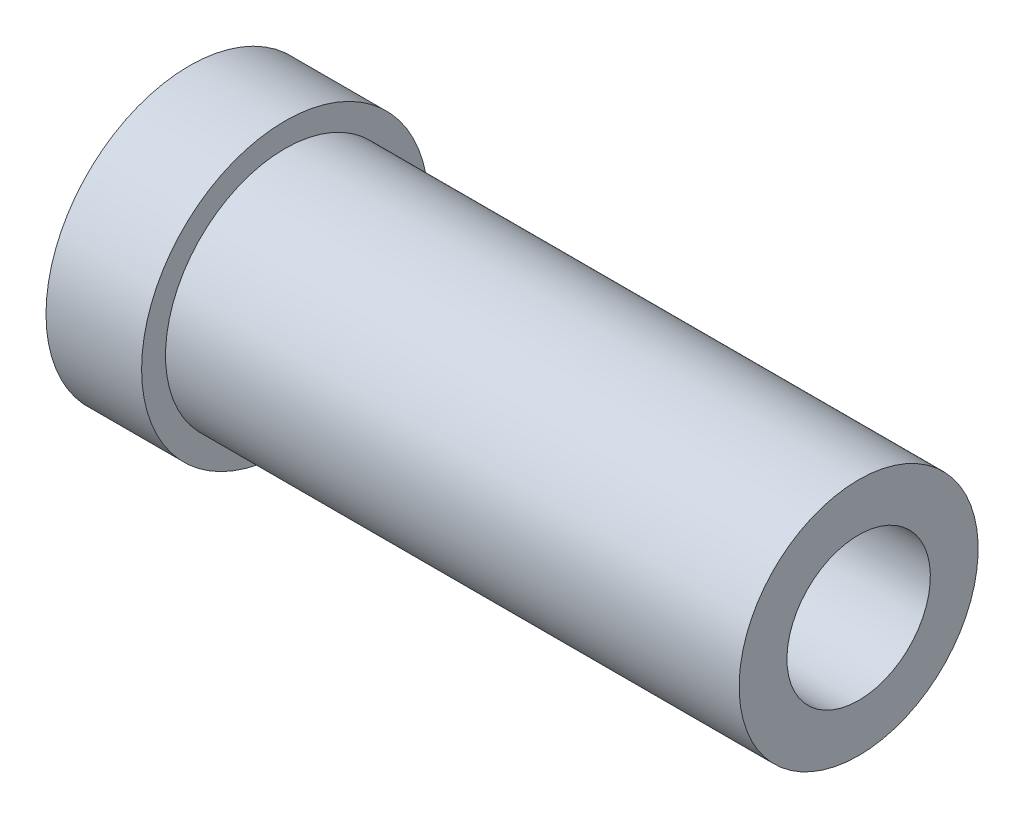
from build123d import *


with BuildPart() as part:
    # Sketch1 → Revolve1 (revolve)
    with BuildSketch(Plane.XY, mode=Mode.PRIVATE) as revolve1_sk:
        Polygon((3.625583913, 2.5), (15.625583913, 2.5), (15.625583913, 1.5), (3.625583913, 1.5), (3.625583913, 0), (1.625583913, 0), (1.625583913, 3), (3.625583913, 3), align=None)
    revolve(revolve1_sk.sketch.rotate(Axis((0, 0, 0), (1, 0, 0)), 180), axis=Axis((0, 0, 0), (1, 0, 0)))


solid = part.part
